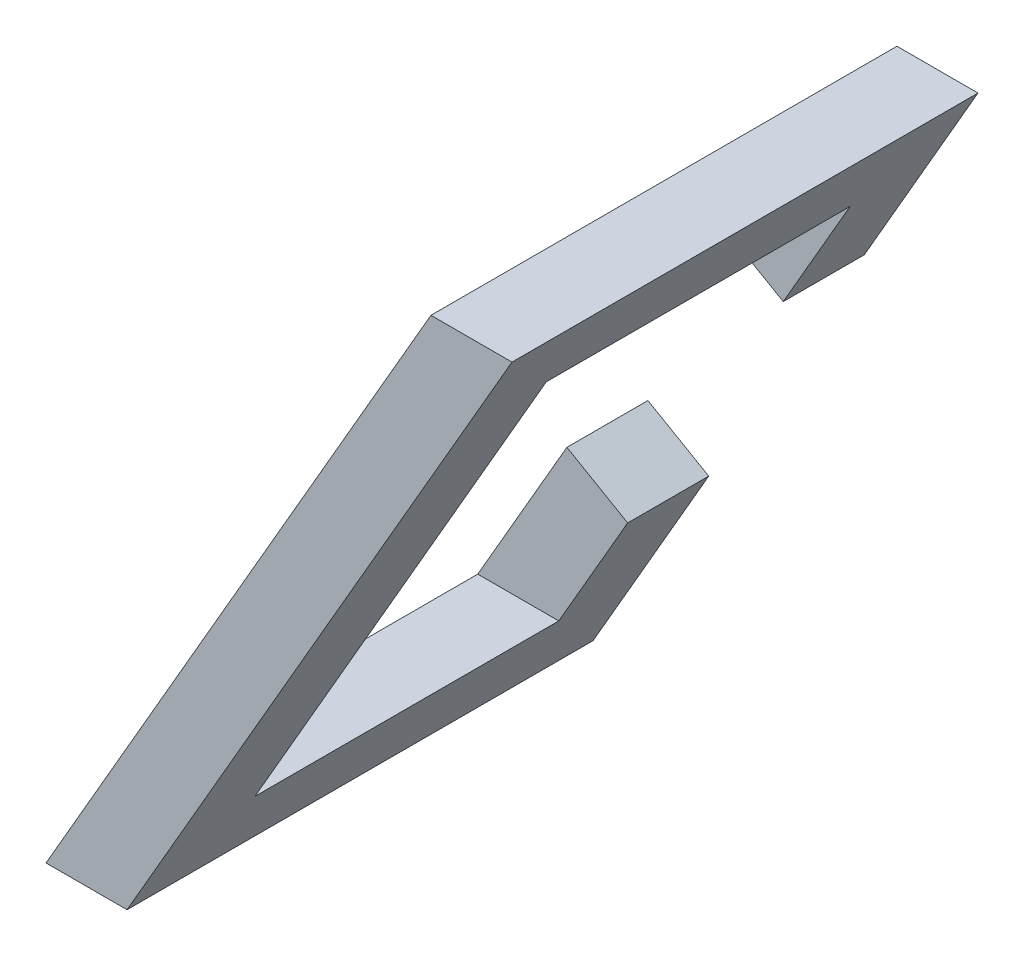
from build123d import *

# Parameters (mm, degrees)
SKETCH1_R           = 5
SKETCH1_R_2         = 3
BOSS_EXTRUDE1_DEPTH = 7
SKETCH2_R           = 3
BOSS_EXTRUDE2_DEPTH = 7
SKETCH3_W           = 16.288395929
SKETCH3_H           = 13.1
BOSS_EXTRUDE3_DEPTH = 4
SKETCH4_W           = 4.517614974
SKETCH4_H           = 7
CUT_EXTRUDE1_DEPTH  = 4
BOSS_EXTRUDE4_DEPTH = 4
BOSS_EXTRUDE5_DEPTH = 4
BOSS_EXTRUDE6_DEPTH = 19
BOSS_EXTRUDE7_DEPTH = 4
BOSS_EXTRUDE8_DEPTH = 8.1
SKETCH10_W          = 12.1
SKETCH10_H          = 15.357517161
CUT_EXTRUDE2_DEPTH  = 90.333377092
CUT_EXTRUDE3_DEPTH  = 87.16880235
SKETCH12_W          = 10.311784895
SKETCH12_H          = 4.86074743
CUT_EXTRUDE4_DEPTH  = 10


with BuildPart() as part:
    # Sketch1 → Boss-Extrude1 (new body)
    with BuildSketch(Plane(origin=(0, 0, 0), x_dir=(1, 0, 0), z_dir=(0, 1, 0))):
        with Locations(Location((0, 0, 0), (0, 0, 270))):
            Circle(SKETCH1_R)
        with Locations(Location((0, 0, 0), (0, 0, 270))):
            Circle(SKETCH1_R_2, mode=Mode.SUBTRACT)
    extrude(amount=BOSS_EXTRUDE1_DEPTH)

    # Sketch2 → Boss-Extrude2 (add, through all)
    with BuildSketch(Plane(origin=(0, 7, 0), x_dir=(1, 0, 0), z_dir=(0, 1, 0))):
        with BuildLine():
            Line((4.582575695, -2), (34.582575695, -2))
            Line((34.582575695, -2), (34.582575695, 2))
            Line((34.582575695, 2), (4.582575695, 2))
            ThreePointArc((4.582575695, 2), (-5, 0), (4.582575695, -2))
        make_face()
        with Locations(Location((0, 0, 0), (0, 0, 270))):
            Circle(SKETCH2_R, mode=Mode.SUBTRACT)
    extrude(amount=-BOSS_EXTRUDE2_DEPTH)

    # Sketch3 → Boss-Extrude3 (add)
    with BuildSketch(Plane.XY.offset(2)):
        with Locations((21.920762757, 6.55)):
            Rectangle(SKETCH3_W, SKETCH3_H)
    extrude(amount=-BOSS_EXTRUDE3_DEPTH)

    # Sketch4 → Cut-Extrude1 (cut)
    with BuildSketch(Plane.XY.offset(2)):
        with Locations((32.323768208, 3.5)):
            Rectangle(SKETCH4_W, SKETCH4_H)
    extrude(amount=-CUT_EXTRUDE1_DEPTH, mode=Mode.SUBTRACT)

    # Sketch5 → Boss-Extrude4 (add)
    with BuildSketch(Plane.XY.offset(2)):
        Polygon((30.064960721, 13.1), (30.064960721, 0), (36.964960721, 0), (50.064960721, 13.1), (76.225581431, 13.1), (80.064960721, 19.75), (80.064960721, 26.4), (43.364960721, 26.4), align=None)
    extrude(amount=-BOSS_EXTRUDE4_DEPTH)

    # Sketch6 → Boss-Extrude5 (add)
    with BuildSketch(Plane.XY.offset(2)):
        Polygon((64.244452646, 36.204482672), (68.244452646, 36.204482672), (49.244452646, 3.295517328), (45.244452646, 3.295517328), align=None)
        Polygon((85.564960721, 36.204482672), (89.564960721, 36.204482672), (70.564960721, 3.295517328), (66.564960721, 3.295517328), align=None)
    extrude(amount=-BOSS_EXTRUDE5_DEPTH)

    # Sketch7 → Boss-Extrude6 (add)
    with BuildSketch(Plane.XY.offset(2)):
        Polygon((68.244452646, 36.204482672), (64.244452646, 36.204482672), (61.935051569, 32.204482672), (65.935051569, 32.204482672), align=None)
        Polygon((85.564960721, 36.204482672), (89.564960721, 36.204482672), (87.255559645, 32.204482672), (83.255559645, 32.204482672), align=None)
        Polygon((66.564960721, 3.295517328), (70.564960721, 3.295517328), (72.874361798, 7.295517328), (68.874361798, 7.295517328), align=None)
        Polygon((45.244452646, 3.295517328), (49.244452646, 3.295517328), (51.553853723, 7.295517328), (47.553853723, 7.295517328), align=None)
    extrude(amount=BOSS_EXTRUDE6_DEPTH)

    # Sketch8 → Boss-Extrude7 (add)
    with BuildSketch(Plane.XY.offset(21)):
        Polygon((64.244452646, 36.204482672), (68.244452646, 36.204482672), (49.244452646, 3.295517328), (45.244452646, 3.295517328), align=None)
        Polygon((85.564960721, 36.204482672), (89.564960721, 36.204482672), (70.564960721, 3.295517328), (66.564960721, 3.295517328), align=None)
    extrude(amount=-BOSS_EXTRUDE7_DEPTH)

    # Sketch9 → Boss-Extrude8 (add)
    with BuildSketch(Plane(origin=(0, 0, -2), x_dir=(-1, 0, 0), z_dir=(0, 0, -1))):
        Polygon((-54.905073356, 13.1), (-62.583831936, 26.4), (-83.95273694, 26.483825938), (-76.273978359, 13.183825938), align=None)
    extrude(amount=BOSS_EXTRUDE8_DEPTH)

    # Sketch10 → Cut-Extrude2 (cut, through all)
    with BuildSketch(Plane(origin=(51.496719679, -29.731644969, 0), x_dir=(0, 0, -1), z_dir=(0.8660254037844388, -0.49999999999999983, 0))):
        with Locations((4.05, 57.233275941)):
            Rectangle(SKETCH10_W, SKETCH10_H)
    extrude(amount=-CUT_EXTRUDE2_DEPTH, mode=Mode.SUBTRACT)

    # Sketch11 → Cut-Extrude3 (cut, through all)
    with BuildSketch(Plane(origin=(48.496719679, -27.999594161, 0), x_dir=(0, 0, 1), z_dir=(-0.8660254037844388, 0.49999999999999983, 0))):
        Polygon((-20.134561074, 86.736839969), (39.285177729, 86.736839969), (39.285177729, 23.813896611), (39.285177729, -9.631836795), (-20.134561074, -9.631836795), (-20.134561074, 23.813896611), align=None)
    extrude(amount=CUT_EXTRUDE3_DEPTH, mode=Mode.SUBTRACT)

    # Sketch12 → Cut-Extrude4 (cut)
    with BuildSketch(Plane(origin=(51.496719679, -29.731644969, 0), x_dir=(0, 0, -1), z_dir=(0.8660254037844388, -0.49999999999999983, 0))):
        with Locations((7.155892448, 47.124143646)):
            Rectangle(SKETCH12_W, SKETCH12_H)
    extrude(amount=-CUT_EXTRUDE4_DEPTH, mode=Mode.SUBTRACT)


solid = part.part
